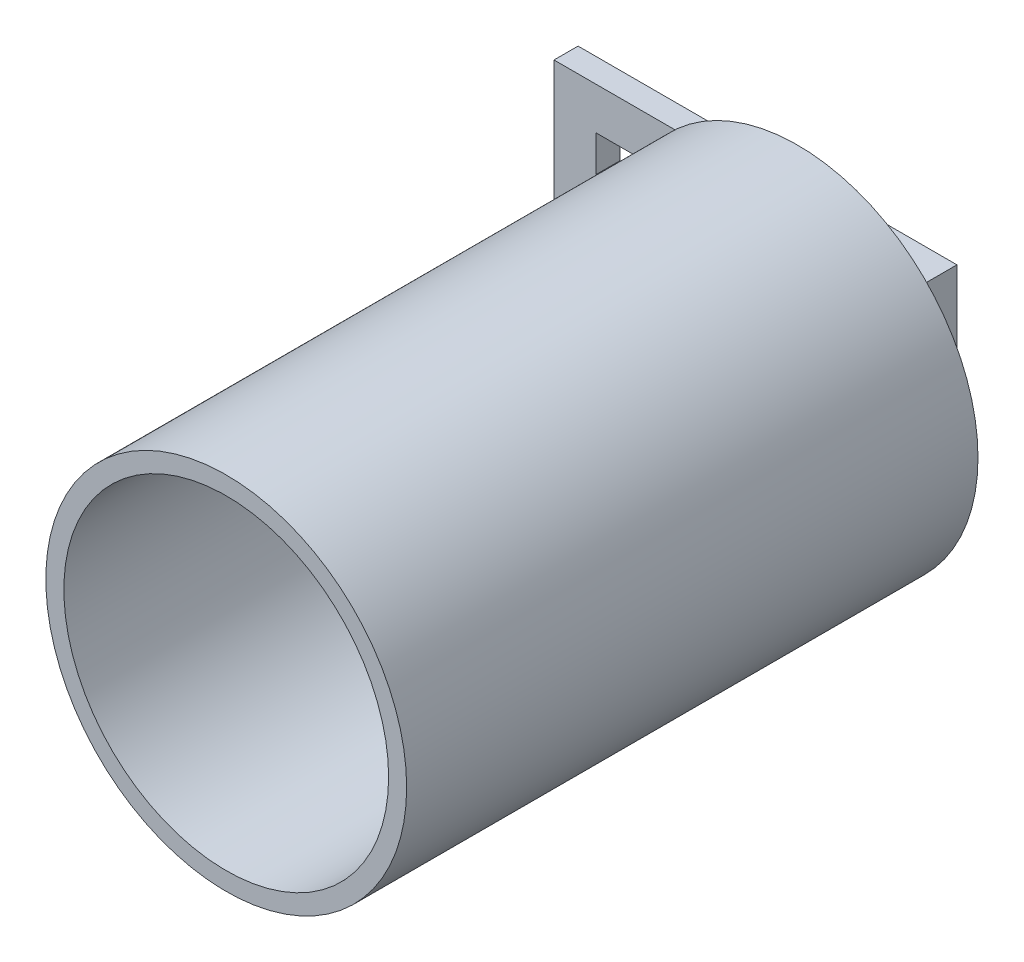
from build123d import *

# Parameters (mm, degrees)
ESQUISSE1_R             = 30
BOSS_EXTRU_1_DEPTH      = 95
ESQUISSE2_R             = 27
ENL_V_MAT_EXTRU_1_DEPTH = 80
ESQUISSE3_W             = 21
ESQUISSE3_H             = 20
BOSS_EXTRU_2_DEPTH      = 16
ESQUISSE4_W             = 4
ESQUISSE4_H             = 20
BOSS_EXTRU_3_DEPTH      = 42
ENL_V_MAT_EXTRU_2_REACH = 128.401
ESQUISSE5_W             = 10
ESQUISSE5_H             = 6


with BuildPart() as part:
    # Esquisse1 → Boss.-Extru.1 (new body)
    with BuildSketch(Plane.XY):
        Circle(ESQUISSE1_R)
    extrude(amount=BOSS_EXTRU_1_DEPTH)

    # Esquisse2 → Enlèv. mat.-Extru.1 (cut)
    with BuildSketch(Plane.XY.offset(95)):
        Circle(ESQUISSE2_R)
    extrude(amount=-ENL_V_MAT_EXTRU_1_DEPTH, mode=Mode.SUBTRACT)

    # Esquisse3 → Boss.-Extru.2 (add)
    with BuildSketch(Plane(origin=(0, 0, 0), x_dir=(-1, 0, 0), z_dir=(0, 0, -1))):
        Rectangle(ESQUISSE3_W, ESQUISSE3_H)
    extrude(amount=BOSS_EXTRU_2_DEPTH)

    # Esquisse4 → Boss.-Extru.3 (add)
    with BuildSketch(Plane.ZY.offset(10.5)):
        with Locations((-14, 0)):
            Rectangle(ESQUISSE4_W, ESQUISSE4_H)
    extrude(amount=BOSS_EXTRU_3_DEPTH)

    # Esquisse5 → Enlèv. mat.-Extru.2 (cut, up to next)
    with BuildSketch(Plane(origin=(0, 0, -16), x_dir=(-1, 0, 0), z_dir=(0, 0, -1)), mode=Mode.PRIVATE) as enl_v_mat_extru_2_sk1:
        with Locations((40.5, 0)):
            Rectangle(ESQUISSE5_W, ESQUISSE5_H)
    enl_v_mat_extru_2_tool1 = extrude(enl_v_mat_extru_2_sk1.sketch, amount=-ENL_V_MAT_EXTRU_2_REACH, mode=Mode.PRIVATE) & part.part
    add(enl_v_mat_extru_2_tool1.solids().sort_by_distance((-40.5, 0, -16))[0], mode=Mode.SUBTRACT)


solid = part.part
